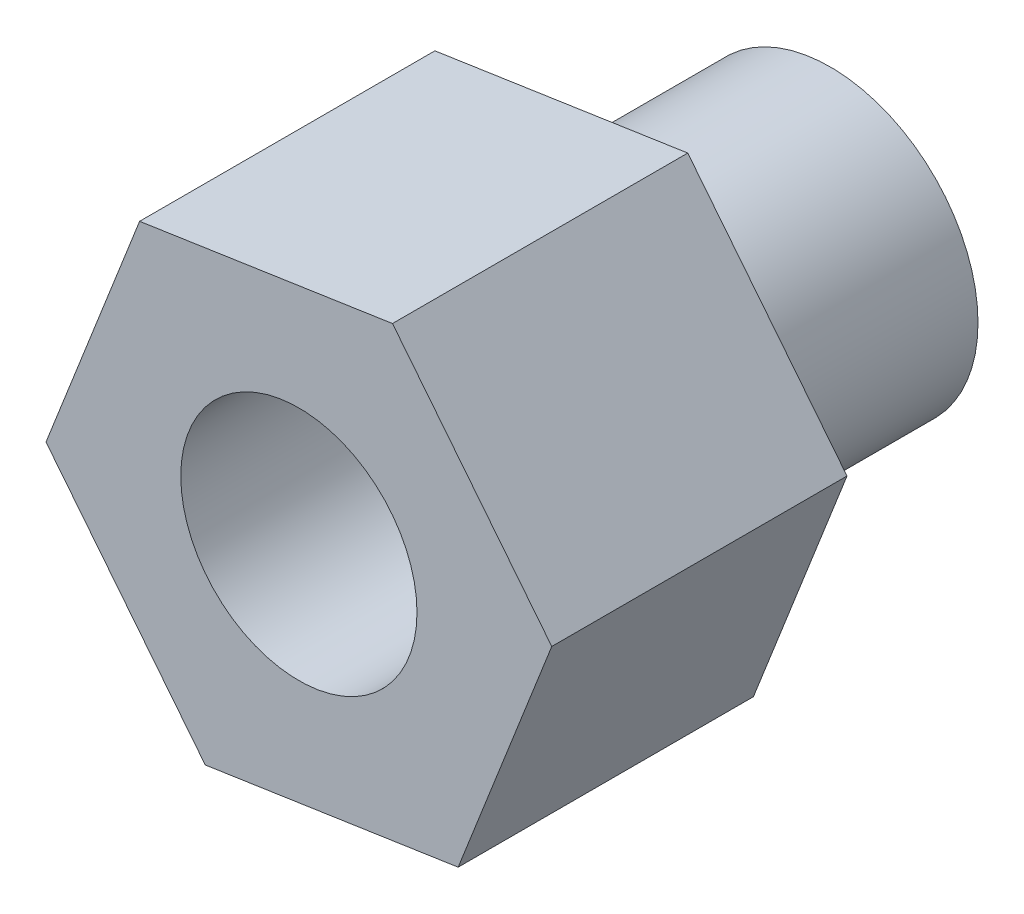
from build123d import *

# Parameters (mm, degrees)
SKETCH_1_R          = 5
EXTRUDE_1_DEPTH     = 8
EXTRUDE_2_DEPTH     = 10
SKETCH_3_R          = 4
CUT_EXTRUDE_3_DEPTH = 22.501180799


with BuildPart() as part:
    # 草图1 → 拉伸1 (new body)
    with BuildSketch(Plane.XY):
        Circle(SKETCH_1_R)
    extrude(amount=EXTRUDE_1_DEPTH)

    # 草图2 → 拉伸2 (add)
    with BuildSketch(Plane.XY.offset(8)):
        Polygon((8.564531463, 1.284056391), (3.170240277, 8.059130014), (-5.394291186, 6.775073623), (-8.564531463, -1.284056391), (-3.170240277, -8.059130014), (5.394291186, -6.775073623), align=None)
    extrude(amount=EXTRUDE_2_DEPTH)

    # 草图3 → 拉伸3 (cut, through all)
    with BuildSketch(Plane.XY.offset(18)):
        Circle(SKETCH_3_R)
    extrude(amount=-CUT_EXTRUDE_3_DEPTH, mode=Mode.SUBTRACT)


solid = part.part
